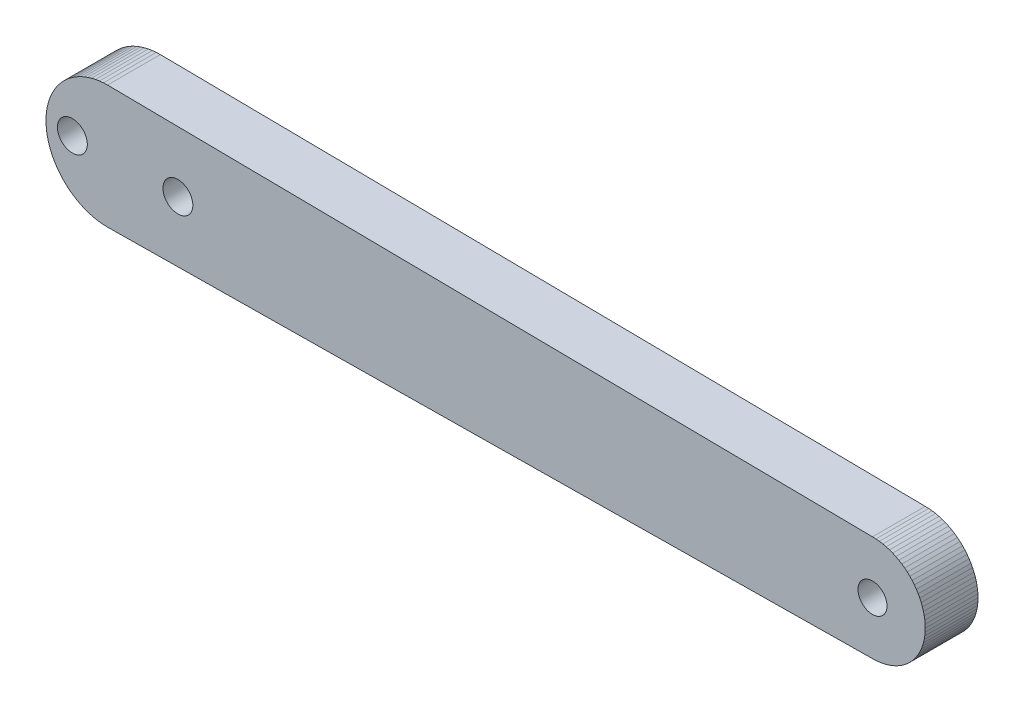
from build123d import *

# Parameters (mm, degrees)
PLATE_DEPTH       = 6
SKETCH2_R         = 1.7
HUB_SCREWS_DEPTH  = 6
SKETCH3_R         = 1.65
KNOB_THREAD_DEPTH = 6


with BuildPart() as part:
    # Sketch1 → Plate (new body)
    with BuildSketch(Plane.XY):
        Polygon((-2, 7), (-2.457821905, 6.985012463), (-2.913683346, 6.94011403), (-3.365632254, 6.865496963), (-3.811733316, 6.761480784), (-4.250076257, 6.628510906), (-4.678784027, 6.467156728), (-5.096020832, 6.278109191), (-5.5, 6.062177826), (-5.888991631, 5.820287286), (-6.261330003, 5.553473382), (-6.615420706, 5.262878652), (-6.949747468, 4.949747468), (-7.262878652, 4.615420706), (-7.553473382, 4.261330003), (-7.820287286, 3.888991631), (-8.062177826, 3.5), (-8.278109191, 3.096020832), (-8.467156728, 2.678784027), (-8.628510906, 2.250076257), (-8.761480784, 1.811733316), (-8.865496963, 1.365632254), (-8.94011403, 0.913683346), (-8.985012463, 0.457821905), (-9, 0), (-8.985012463, -0.457821905), (-8.94011403, -0.913683346), (-8.865496963, -1.365632254), (-8.761480784, -1.811733316), (-8.628510906, -2.250076257), (-8.467156728, -2.678784027), (-8.278109191, -3.096020832), (-8.062177826, -3.5), (-7.820287286, -3.888991631), (-7.553473382, -4.261330003), (-7.262878652, -4.615420706), (-6.949747468, -4.949747468), (-6.615420706, -5.262878652), (-6.261330003, -5.553473382), (-5.888991631, -5.820287286), (-5.5, -6.062177826), (-5.096020832, -6.278109191), (-4.678784027, -6.467156728), (-4.250076257, -6.628510906), (-3.811733316, -6.761480784), (-3.365632254, -6.865496963), (-2.913683346, -6.94011403), (-2.457821905, -6.985012463), (-2, -7), (85, -6), (85.392418775, -5.987153539), (85.783157153, -5.948669168), (86.170541932, -5.884711682), (86.552914271, -5.795554958), (86.928636792, -5.681580777), (87.296100594, -5.543277195), (87.653732141, -5.381236449), (88, -5.196152423), (88.333421398, -4.988817674), (88.652568574, -4.760120042), (88.956074891, -4.511038845), (89.242640687, -4.242640687), (89.511038845, -3.956074891), (89.760120042, -3.652568574), (89.988817674, -3.333421398), (90.196152423, -3), (90.381236449, -2.653732141), (90.543277195, -2.296100594), (90.681580777, -1.928636792), (90.795554958, -1.552914271), (90.884711682, -1.170541932), (90.948669168, -0.783157153), (90.987153539, -0.392418775), (91, 0), (90.987153539, 0.392418775), (90.948669168, 0.783157153), (90.884711682, 1.170541932), (90.795554958, 1.552914271), (90.681580777, 1.928636792), (90.543277195, 2.296100594), (90.381236449, 2.653732141), (90.196152423, 3), (89.988817674, 3.333421398), (89.760120042, 3.652568574), (89.511038845, 3.956074891), (89.242640687, 4.242640687), (88.956074891, 4.511038845), (88.652568574, 4.760120042), (88.333421398, 4.988817674), (88, 5.196152423), (87.653732141, 5.381236449), (87.296100594, 5.543277195), (86.928636792, 5.681580777), (86.552914271, 5.795554958), (86.170541932, 5.884711682), (85.783157153, 5.948669168), (85.392418775, 5.987153539), (85, 6), align=None)
    extrude(amount=PLATE_DEPTH)

    # Sketch2 → Hub_screws (cut)
    with BuildSketch(Plane.XY):
        with Locations((-6, 0)):
            Circle(SKETCH2_R)
        with Locations((6, 0)):
            Circle(SKETCH2_R)
    extrude(amount=HUB_SCREWS_DEPTH, mode=Mode.SUBTRACT)

    # Sketch3 → Knob_thread (cut)
    with BuildSketch(Plane.XY):
        with Locations((85, 0)):
            Circle(SKETCH3_R)
    extrude(amount=KNOB_THREAD_DEPTH, mode=Mode.SUBTRACT)


solid = part.part
